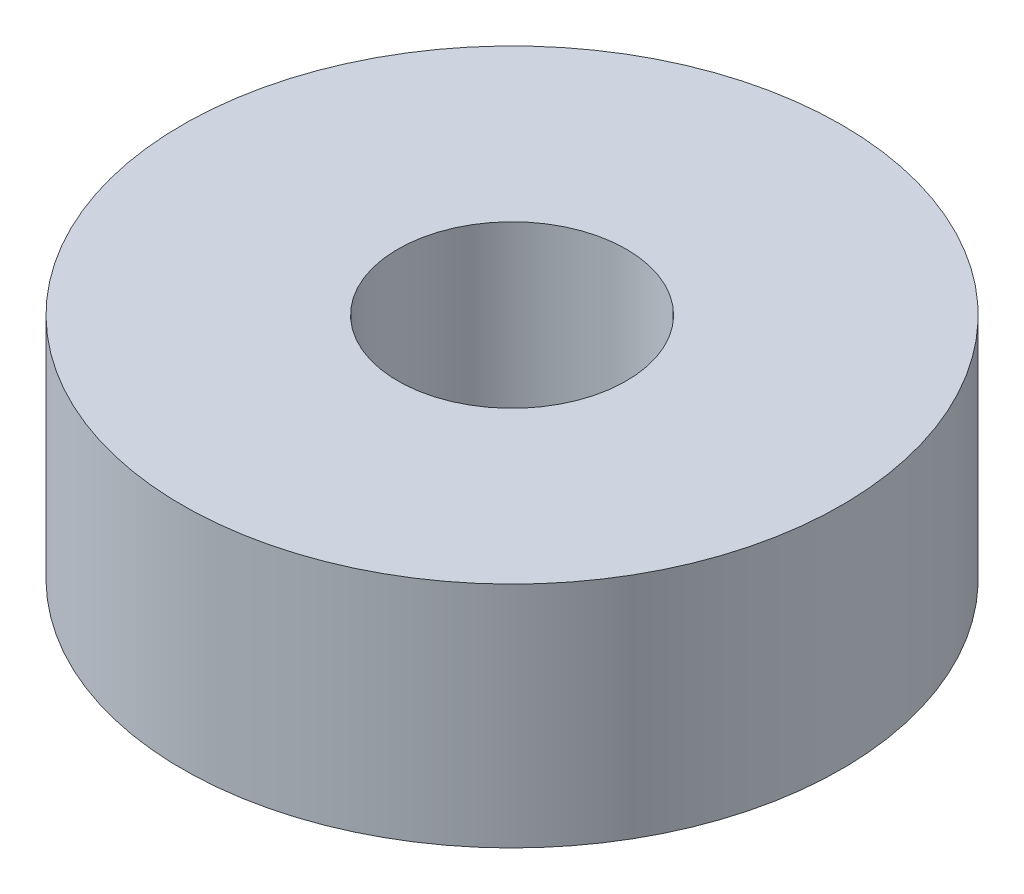
from build123d import *

# Parameters (mm, degrees)
SKETCH1_R           = 9.525
SKETCH1_R_2         = 3.302
BOSS_EXTRUDE1_DEPTH = 6.604


with BuildPart() as part:
    # Sketch1 → Boss-Extrude1 (new body)
    with BuildSketch(Plane(origin=(0, 0, 0), x_dir=(1, 0, 0), z_dir=(0, 1, 0))):
        with Locations(Location((0, 0, 0), (0, 0, 90))):
            Circle(SKETCH1_R)
        with Locations(Location((0, 0, 0), (0, 0, 90))):
            Circle(SKETCH1_R_2, mode=Mode.SUBTRACT)
    extrude(amount=BOSS_EXTRUDE1_DEPTH)


solid = part.part
